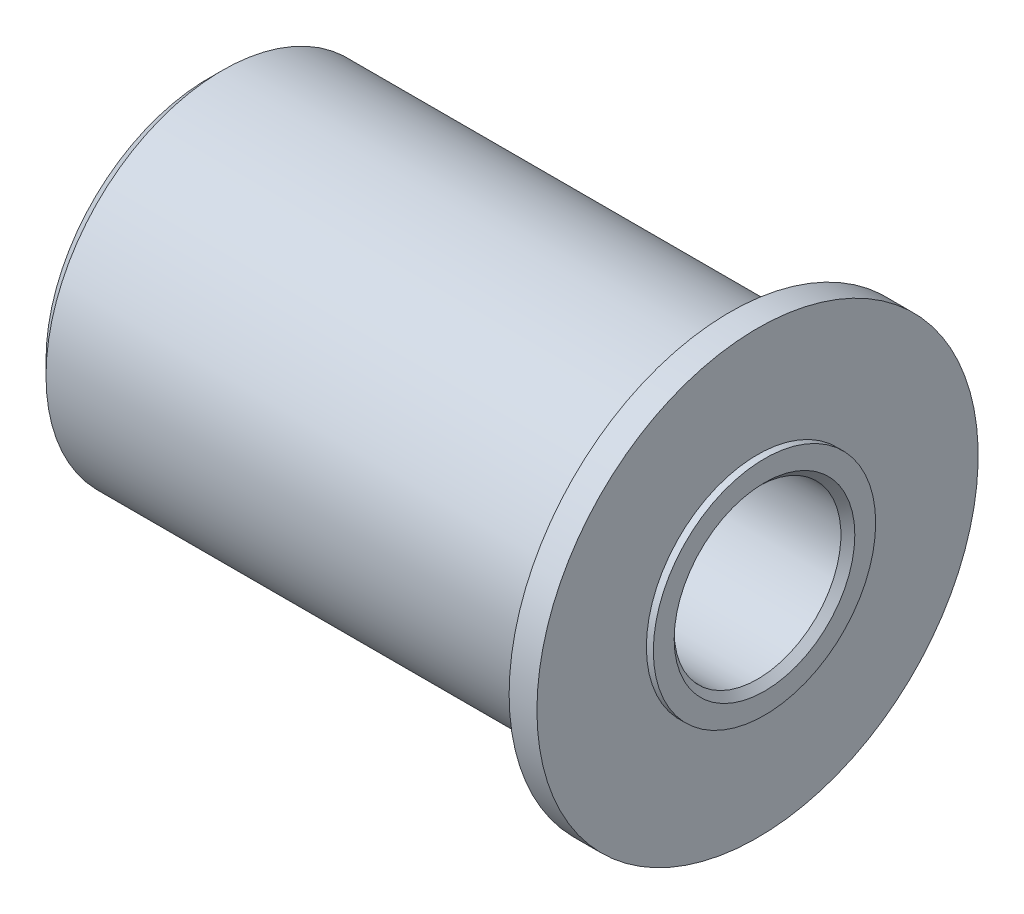
from build123d import *


with BuildPart() as part:
    # Croquis1 → Revolución1 (revolve)
    with BuildSketch(Plane.XY, mode=Mode.PRIVATE) as revoluci_n1_sk:
        Polygon((1, 12.7), (37.5, 12.7), (37.5, 15.875), (39.5, 15.875), (39.5, 8), (40, 8), (40, 6.5), (39.5, 6), (1, 6), (0, 7), (0, 11.7), align=None)
    revolve(revoluci_n1_sk.sketch.rotate(Axis((0, 0, 0), (1, 0, 0)), 90), axis=Axis((0, 0, 0), (1, 0, 0)))


solid = part.part
